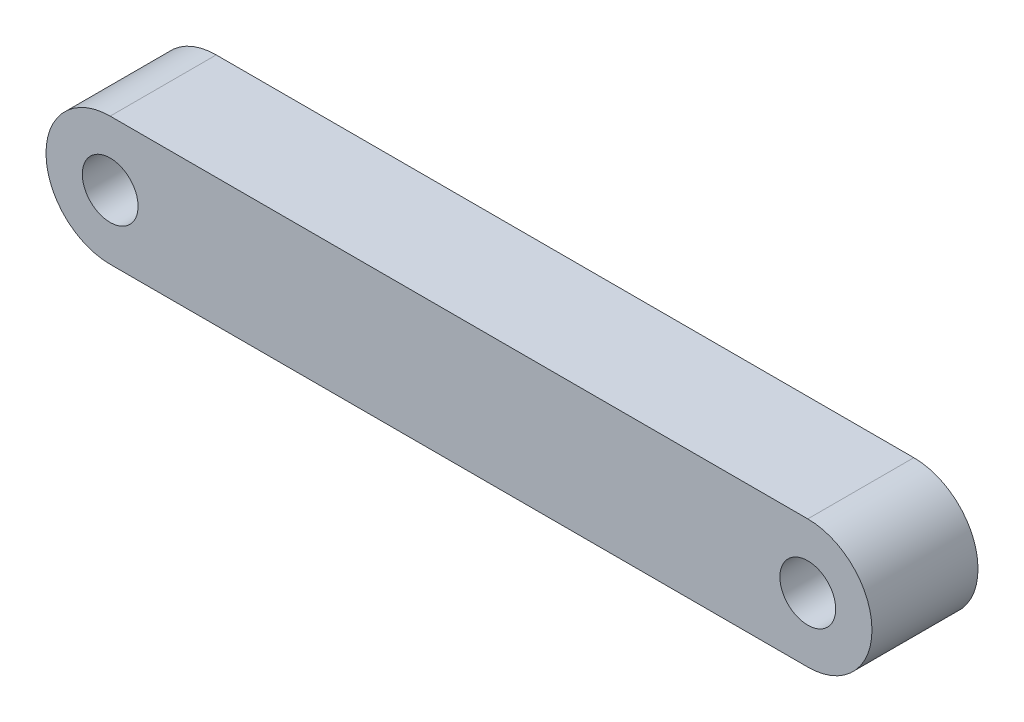
from build123d import *

# Parameters (mm, degrees)
SKETCH1_R           = 1
BOSS_EXTRUDE1_DEPTH = 3.8


with BuildPart() as part:
    # Sketch1 → Boss-Extrude1 (new body)
    with BuildSketch(Plane.XY):
        with BuildLine():
            Line((0, 2.3), (25, 2.3))
            ThreePointArc((25, 2.3), (27.3, 0), (25, -2.3))
            Line((25, -2.3), (0, -2.3))
            ThreePointArc((0, -2.3), (-2.3, 0), (0, 2.3))
        make_face()
        with Locations(Location((0, 0, 0), (0, 0, 180))):
            Circle(SKETCH1_R, mode=Mode.SUBTRACT)
        with Locations(Location((25, 0, 0), (0, 0, 180))):
            Circle(SKETCH1_R, mode=Mode.SUBTRACT)
    extrude(amount=BOSS_EXTRUDE1_DEPTH)


solid = part.part
